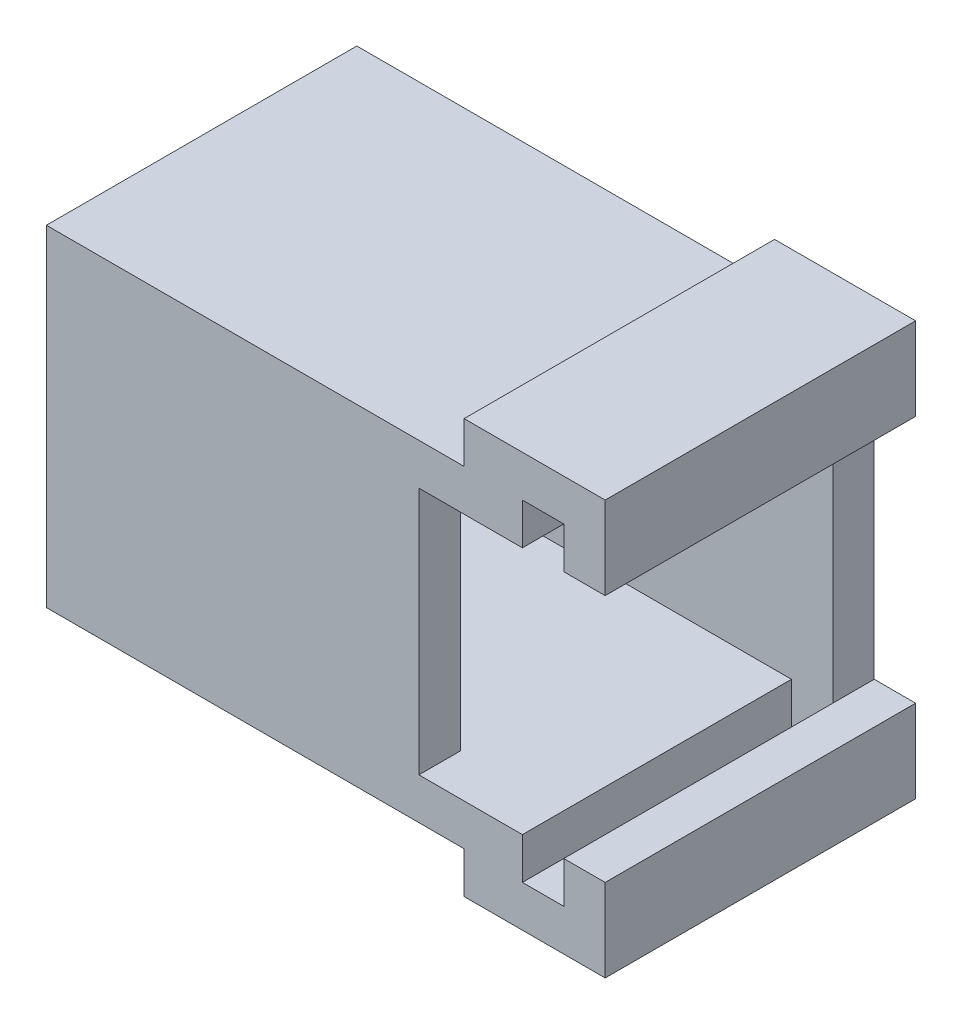
from build123d import *

# Parameters (mm, degrees)
CROQUIS1_W              = 23
CROQUIS1_H              = 16
SALIENTE_EXTRUIR1_DEPTH = 15
CROQUIS2_W              = 11
CROQUIS2_H              = 12
CORTAR_EXTRUIR1_DEPTH   = 21
CROQUIS4_R              = 4
CORTAR_EXTRUIR2_DEPTH   = 23
CROQUIS5_W              = 5
CROQUIS5_H              = 12
CORTAR_EXTRUIR3_DEPTH   = 2
SALIENTE_EXTRUIR2_DEPTH = 15
CROQUIS7_W              = 2
CROQUIS7_H              = 16
SALIENTE_EXTRUIR3_DEPTH = 2


with BuildPart() as part:
    # Croquis1 → Saliente-Extruir1 (new body)
    with BuildSketch(Plane.XY):
        with Locations((11.5, 8)):
            Rectangle(CROQUIS1_W, CROQUIS1_H)
    extrude(amount=SALIENTE_EXTRUIR1_DEPTH)

    # Croquis2 → Cortar-Extruir1 (cut)
    with BuildSketch(Plane(origin=(23, 0, 0), x_dir=(0, 0, -1), z_dir=(1, 0, 0))):
        with Locations((-7.5, 8)):
            Rectangle(CROQUIS2_W, CROQUIS2_H)
    extrude(amount=-CORTAR_EXTRUIR1_DEPTH, mode=Mode.SUBTRACT)

    # Croquis4 → Cortar-Extruir2 (cut)
    with BuildSketch(Plane.ZY):
        with Locations((7.5, 8)):
            Circle(CROQUIS4_R)
    extrude(amount=-CORTAR_EXTRUIR2_DEPTH, mode=Mode.SUBTRACT)

    # Croquis5 → Cortar-Extruir3 (cut)
    with BuildSketch(Plane.XY.offset(15)):
        with Locations((20.5, 8)):
            Rectangle(CROQUIS5_W, CROQUIS5_H)
    extrude(amount=-CORTAR_EXTRUIR3_DEPTH, mode=Mode.SUBTRACT)

    # Croquis6 → Saliente-Extruir2 (add)
    with BuildSketch(Plane.XY.offset(15)):
        Polygon((20.184075088, 16), (20.184075088, 18), (27, 18), (27, 14), (25, 14), (25, 16), (23, 16), align=None)
        Polygon((20.184075088, 0), (23, 0), (25, 0), (25, 2), (27, 2), (27, -2), (20.184075088, -2), align=None)
    extrude(amount=-SALIENTE_EXTRUIR2_DEPTH)

    # Croquis7 → Saliente-Extruir3 (add)
    with BuildSketch(Plane(origin=(0, 0, 0), x_dir=(-1, 0, 0), z_dir=(0, 0, -1))):
        with Locations((-24, 8)):
            Rectangle(CROQUIS7_W, CROQUIS7_H)
    extrude(amount=-SALIENTE_EXTRUIR3_DEPTH)


solid = part.part
